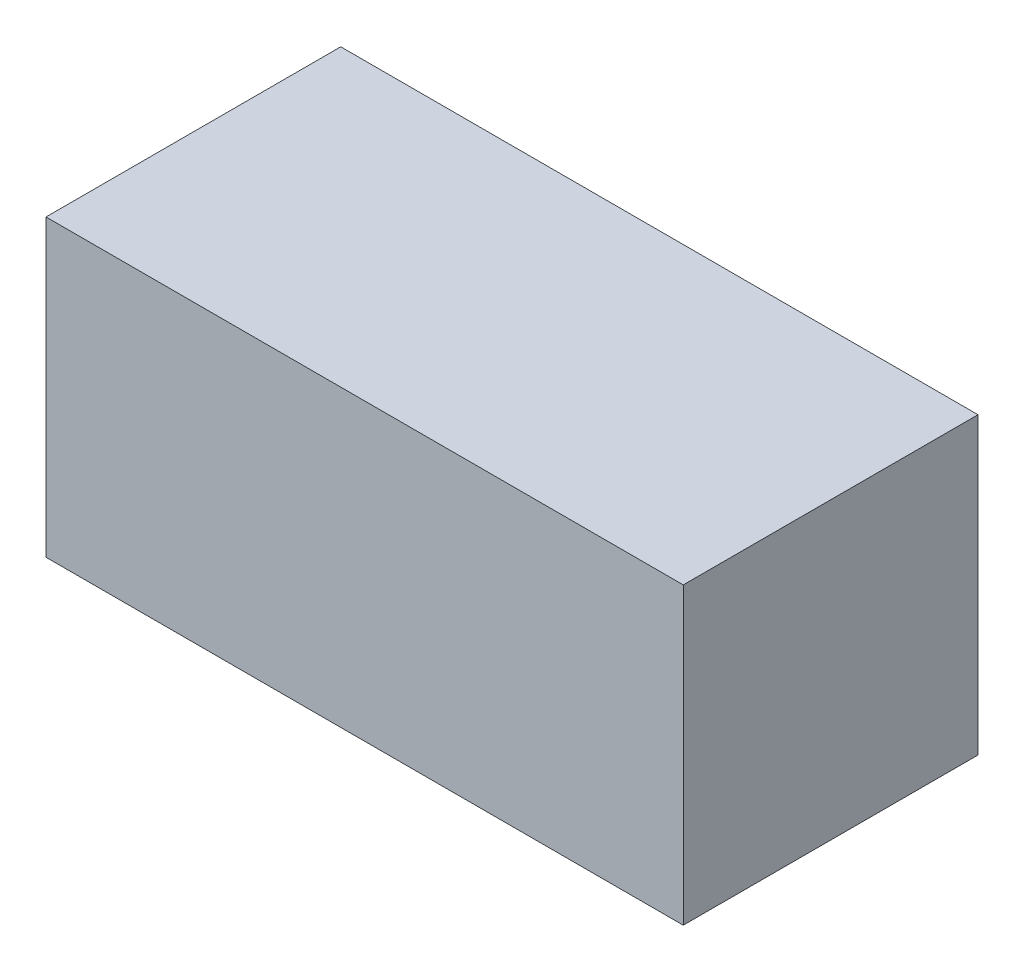
from build123d import *

# Parameters (mm, degrees)
MTG_MOTOR_24V_37X37X80_1_START = 18.5
SKETCH1_W                      = 80
SKETCH1_H                      = 37
MTG_MOTOR_24V_37X37X80_1_DEPTH = 37


with BuildPart() as part:
    # Sketch1 → MTG_motor_24V_37x37x80_1 (new body)
    with BuildSketch(Plane.XY.offset(MTG_MOTOR_24V_37X37X80_1_START)):
        with Locations((88, 0)):
            Rectangle(SKETCH1_W, SKETCH1_H)
    extrude(amount=-MTG_MOTOR_24V_37X37X80_1_DEPTH)


solid = part.part
